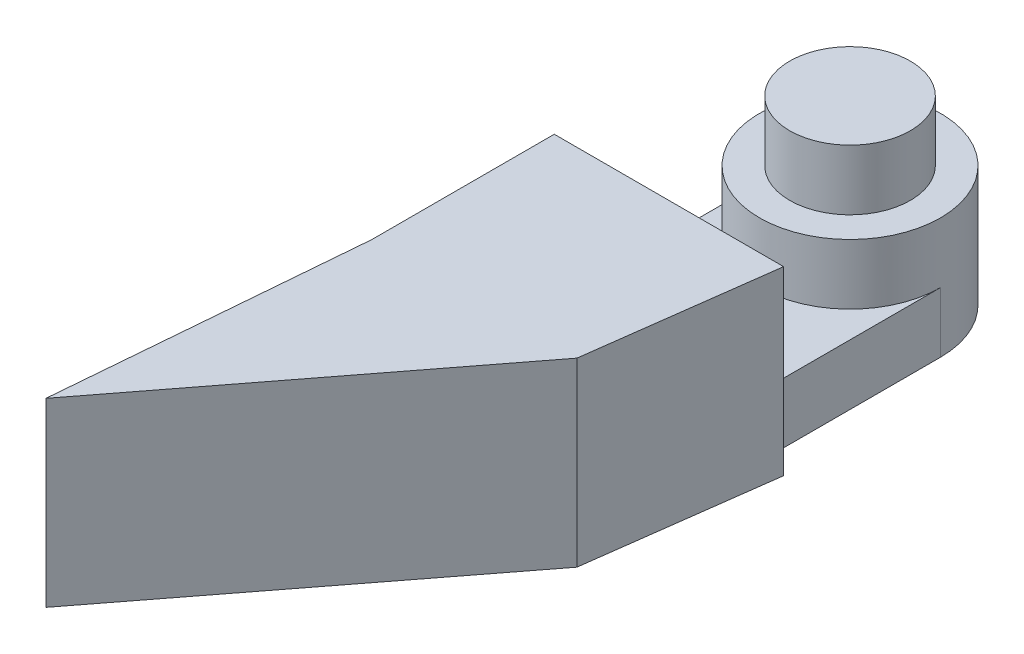
from build123d import *

# Parameters (mm, degrees)
SKETCH1_6_R         = 5
BOSS_EXTRUDE5_DEPTH = 15
SKETCH1_7_R         = 7.5
SKETCH1_7_R_2       = 5
BOSS_EXTRUDE6_DEPTH = 10
BOSS_EXTRUDE7_DEPTH = 5
BOSS_EXTRUDE8_DEPTH = 15


with BuildPart() as part:
    # Sketch1<6> → Boss-Extrude5 (new body)
    with BuildSketch(Plane(origin=(0, 0, 0), x_dir=(1, 0, 0), z_dir=(0, 1, 0))):
        with Locations((98.929018633, 0)):
            Circle(SKETCH1_6_R)
    extrude(amount=BOSS_EXTRUDE5_DEPTH)

    # Sketch1<7> → Boss-Extrude6 (add)
    with BuildSketch(Plane(origin=(0, 0, 0), x_dir=(1, 0, 0), z_dir=(0, 1, 0))):
        with Locations((98.929018633, 0)):
            Circle(SKETCH1_7_R)
        with Locations((98.929018633, 0)):
            Circle(SKETCH1_7_R_2, mode=Mode.SUBTRACT)
    extrude(amount=BOSS_EXTRUDE6_DEPTH)

    # Sketch1<8> → Boss-Extrude7 (add)
    with BuildSketch(Plane(origin=(0, 0, 0), x_dir=(1, 0, 0), z_dir=(0, 1, 0))):
        with BuildLine():
            ThreePointArc((106.429018633, 0), (98.929018633, -7.5), (91.429018633, 0))
            Line((91.429018633, 0), (91.429018633, -15))
            Line((91.429018633, -15), (106.429018633, -15))
            Line((106.429018633, -15), (106.429018633, 0))
        make_face()
    extrude(amount=BOSS_EXTRUDE7_DEPTH)

    # Sketch1<9> → Boss-Extrude8 (add)
    with BuildSketch(Plane(origin=(0, 0, 0), x_dir=(1, 0, 0), z_dir=(0, 1, 0))):
        Polygon((106.429018633, -15), (91.429018633, -15), (89.429018633, -15), (89.429018633, -30.12715853), (87.321654073, -55), (106.429018633, -30.12715853), (108.429018633, -15), align=None)
    extrude(amount=BOSS_EXTRUDE8_DEPTH)


solid = part.part
